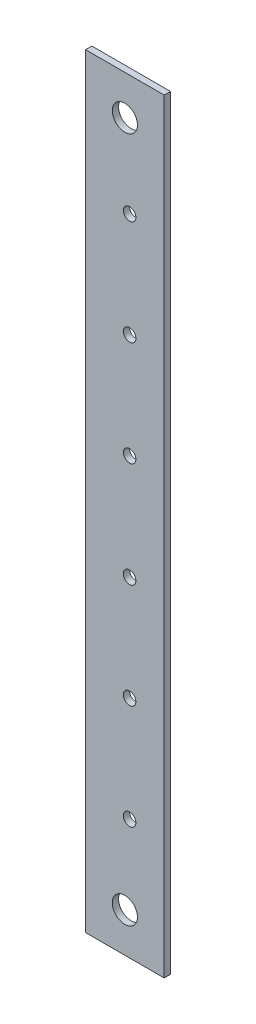
from build123d import *

# Parameters (mm, degrees)
SKETCH1_R           = 4
BOSS_EXTRUDE1_DEPTH = 2
SKETCH2_R           = 2
CUT_EXTRUDE1_DEPTH  = 2


with BuildPart() as part:
    # Sketch1 → Boss-Extrude1 (new body)
    with BuildSketch(Plane.XY):
        Polygon((3.5, 121.5), (12.5, 121.5), (12.5, -121.5), (3.5, -121.5), (0, -121.5), (-12.5, -121.5), (-12.5, -115.487492178), (-12.5, -105.5), (-12.5, 112.5), (-12.5, 121.5), align=None)
        with Locations((0, 109)):
            Circle(SKETCH1_R, mode=Mode.SUBTRACT)
        with Locations(Location((0, -109, 0), (0, 0, 180))):
            Circle(SKETCH1_R, mode=Mode.SUBTRACT)
    extrude(amount=BOSS_EXTRUDE1_DEPTH)

    # Sketch2 → Cut-Extrude1 (cut)
    with BuildSketch(Plane.XY.offset(2)):
        with Locations((1.5, 83.3)):
            Circle(SKETCH2_R)
        with Locations((1.5, 50)):
            Circle(SKETCH2_R)
        with Locations((1.5, 16.7)):
            Circle(SKETCH2_R)
        with Locations((1.5, -16.7)):
            Circle(SKETCH2_R)
        with Locations((1.5, -50)):
            Circle(SKETCH2_R)
        with Locations((1.5, -83.3)):
            Circle(SKETCH2_R)
    extrude(amount=-CUT_EXTRUDE1_DEPTH, mode=Mode.SUBTRACT)


solid = part.part
